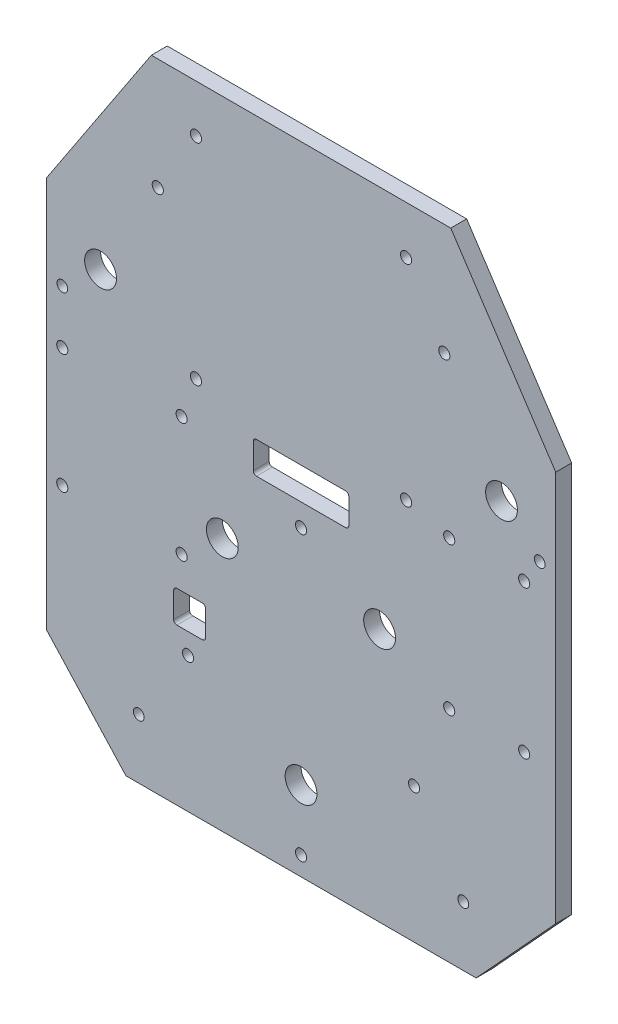
from build123d import *

# Parameters (mm, degrees)
ESQUISSE1_W                                  = 200
ESQUISSE1_H                                  = 160
ESQUISSE1_R                                  = 5
ESQUISSE1_R_2                                = 1.75
ESQUISSE1_W_2                                = 10
ESQUISSE1_H_2                                = 10
ESQUISSE1_H_3                                = 30
BOSS_EXTRU_1_DEPTH                           = 5
CONG_2_R                                     = 1
ENL_V_MAT_EXTRU_1_DEPTH                      = 129.16005618
ESQUISSE3_R                                  = 1.75
TROU_CUVE_DIRECTION_DEPTH                    = 129.16005618
ESQUISSE4_R                                  = 1.7
ESQUISSE4_R_2                                = 5
POINTE_AVANT_TROUS_BATTERIES_ET_CABLES_DEPTH = 129.16005618


with BuildPart() as part:
    # Esquisse1 → Boss.-Extru.1 (new body)
    with BuildSketch(Plane(origin=(0, 0, 0), x_dir=(0, 1, 0), z_dir=(0, 0, 1))):
        Rectangle(ESQUISSE1_W, ESQUISSE1_H)
        with Locations(Location((-75, 0, 0), (0, 0, 270))):
            Circle(ESQUISSE1_R, mode=Mode.SUBTRACT)
        with Locations(Location((-57.5, 35.5, 0), (0, 0, 270))):
            Circle(ESQUISSE1_R_2, mode=Mode.SUBTRACT)
        with Locations(Location((-57.5, -35.5, 0), (0, 0, 90))):
            Circle(ESQUISSE1_R_2, mode=Mode.SUBTRACT)
        with Locations(Location((65, 45, 0), (0, 0, 270))):
            Circle(ESQUISSE1_R_2, mode=Mode.SUBTRACT)
        with Locations(Location((65, -45, 0), (0, 0, 90))):
            Circle(ESQUISSE1_R_2, mode=Mode.SUBTRACT)
        with Locations(Location((-31, 37.5, 0), (0, 0, 270))):
            Circle(ESQUISSE1_R_2, mode=Mode.SUBTRACT)
        with Locations(Location((-31, 75, 0), (0, 0, 270))):
            Circle(ESQUISSE1_R_2, mode=Mode.SUBTRACT)
        with Locations(Location((6.5, 75, 0), (0, 0, 270))):
            Circle(ESQUISSE1_R_2, mode=Mode.SUBTRACT)
        with Locations(Location((6.5, 37.5, 0), (0, 0, 270))):
            Circle(ESQUISSE1_R_2, mode=Mode.SUBTRACT)
        with Locations(Location((-31, -46.541307377, 0), (0, 0, 270))):
            Circle(ESQUISSE1_R_2, mode=Mode.SUBTRACT)
        with Locations(Location((-31, -70.091307377, 0), (0, 0, 270))):
            Circle(ESQUISSE1_R_2, mode=Mode.SUBTRACT)
        with Locations(Location((15.5, -46.541307377, 0), (0, 0, 270))):
            Circle(ESQUISSE1_R_2, mode=Mode.SUBTRACT)
        with Locations(Location((15.5, -70.091307377, 0), (0, 0, 270))):
            Circle(ESQUISSE1_R_2, mode=Mode.SUBTRACT)
        with Locations(Location((-4.999283545, 0, 0), (0, 0, 270))):
            Circle(ESQUISSE1_R_2, mode=Mode.SUBTRACT)
        with Locations(Location((85, 33, 0), (0, 0, 270))):
            Circle(ESQUISSE1_R_2, mode=Mode.SUBTRACT)
        with Locations(Location((85.001189598, -32.999999989, 0), (0, 0, 270))):
            Circle(ESQUISSE1_R_2, mode=Mode.SUBTRACT)
        with Locations(Location((19, 33, 0), (0, 0, 270))):
            Circle(ESQUISSE1_R_2, mode=Mode.SUBTRACT)
        with Locations(Location((19.001189598, -32.999999989, 0), (0, 0, 270))):
            Circle(ESQUISSE1_R_2, mode=Mode.SUBTRACT)
        with Locations((-46, 35)):
            Rectangle(ESQUISSE1_W_2, ESQUISSE1_H_2, mode=Mode.SUBTRACT)
        with Locations((7, 0)):
            Rectangle(ESQUISSE1_W_2, ESQUISSE1_H_3, mode=Mode.SUBTRACT)
    extrude(amount=BOSS_EXTRU_1_DEPTH)

    # Congé2
    cong_2_edges = [part.edges().sort_by_distance(p)[0] for p in [
        (-40, -51, 2.5),
        (-30, -51, 2.5),
        (-30, -41, 2.5),
        (-40, -41, 2.5),
        (-15, 2, 2.5),
        (15, 2, 2.5),
        (15, 12, 2.5),
        (-15, 12, 2.5),
    ]]
    fillet(cong_2_edges, radius=CONG_2_R)

    # Esquisse2 → Enlèv. mat.-Extru.1 (cut, through all)
    with BuildSketch(Plane.XY.offset(5)):
        Polygon((-573.580399643, 598.167108478), (-698.698151963, -488.082468479), (684.299979338, -647.380682556), (762.904681953, 702.431902078), align=None)
        Polygon((-110, 40), (0, 160), (110, 40), (110, -40), (0, -160), (-110, -40), align=None, mode=Mode.SUBTRACT)
    extrude(amount=-ENL_V_MAT_EXTRU_1_DEPTH, mode=Mode.SUBTRACT)

    # Esquisse3 → Trou cuve direction (cut, through all)
    with BuildSketch(Plane(origin=(0, 0, 0), x_dir=(0, 1, 0), z_dir=(0, 0, 1))):
        with Locations(Location((-94.001515359, 0.004041019, 0), (0, 0, 270))):
            Circle(ESQUISSE3_R)
    extrude(amount=TROU_CUVE_DIRECTION_DEPTH, mode=Mode.SUBTRACT)

    # Esquisse4 → Pointe avant, trous batteries et cables (cut, through all)
    with BuildSketch(Plane.XY.offset(5)):
        with Locations((-50.974041019, -81.261515359)):
            Circle(ESQUISSE4_R)
        with Locations((-74.974041019, 23.238484641)):
            Circle(ESQUISSE4_R)
        with Locations((50.965958981, -81.261515359)):
            Circle(ESQUISSE4_R)
        with Locations((74.965958981, 23.238484641)):
            Circle(ESQUISSE4_R)
        with Locations((-62.974041019, 33.738484641)):
            Circle(ESQUISSE4_R_2)
        with Locations((62.965958981, 33.738484641)):
            Circle(ESQUISSE4_R_2)
        with Locations((-24.724041019, -20.261515359)):
            Circle(ESQUISSE4_R_2)
        with Locations((24.675958981, -20.261515359)):
            Circle(ESQUISSE4_R_2)
        Polygon((-82.024041019, 47.038484641), (-45.024041019, 103.038484641), (-83.024041019, 103.038484641), (-83.024041019, 47.038484641), align=None)
        Polygon((82.015958981, 47.038484641), (45.015958981, 103.038484641), (83.015958981, 103.038484641), (83.015958981, 47.038484641), align=None)
    extrude(amount=-POINTE_AVANT_TROUS_BATTERIES_ET_CABLES_DEPTH, mode=Mode.SUBTRACT)


solid = part.part
